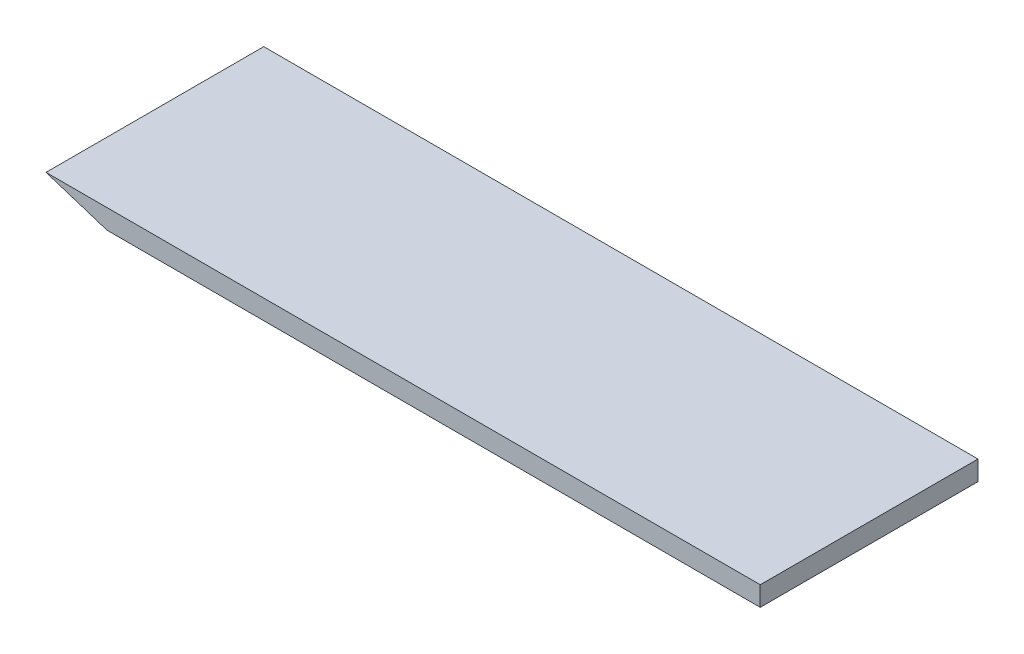
from build123d import *

# Parameters (mm, degrees)
BOSS_EXTRUDE1_DEPTH = 100


with BuildPart() as part:
    # Sketch1 → Boss-Extrude1 (new body)
    with BuildSketch(Plane.XY):
        Polygon((0, 0), (328, 0), (328, -9), (28, -9), align=None)
    extrude(amount=BOSS_EXTRUDE1_DEPTH)


solid = part.part
